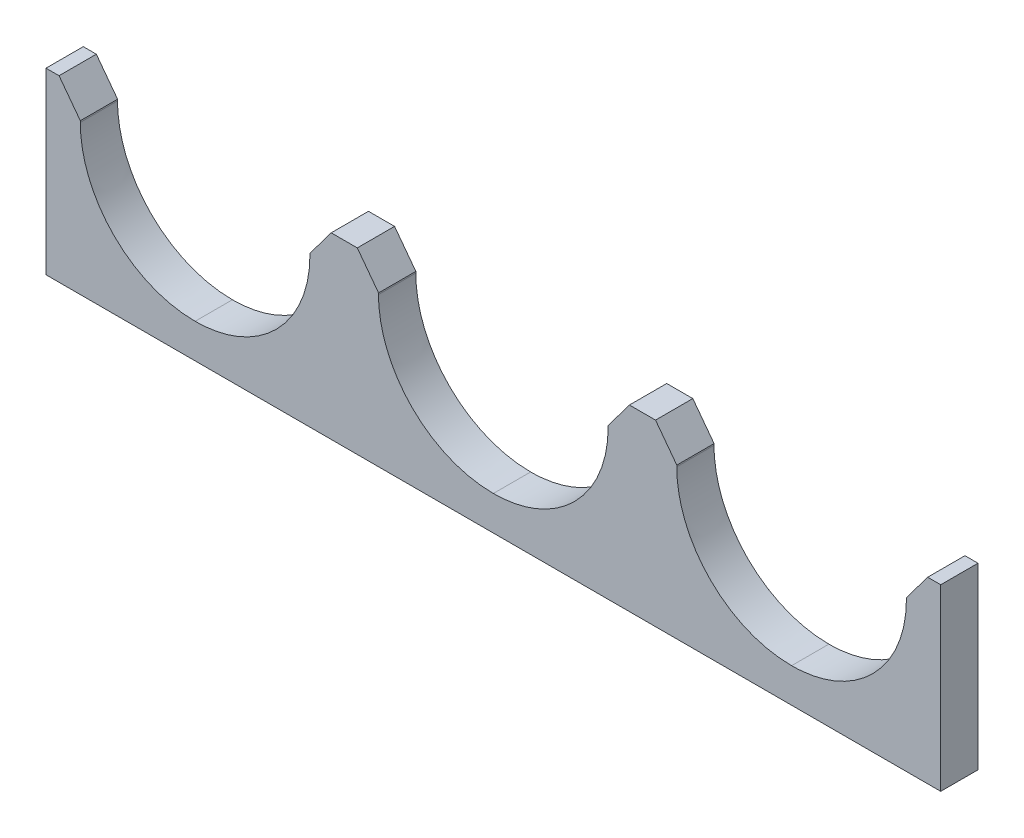
from build123d import *

# Parameters (mm, degrees)
BOSS_EXTRU_1_DEPTH = 12.5


with BuildPart() as part:
    # Model → Boss.-Extru.1 (new body)
    with BuildSketch(Plane.XY):
        with BuildLine():
            Line((245.987396918, -237.241344783), (238.857836405, -227.732795114))
            Line((238.857836405, -227.732795114), (230.104537794, -227.732795114))
            Line((230.104537794, -227.732795114), (222.97495575, -237.241366315))
            add(Edge.make_bspline(
                [(222.97495575, -237.241366315), (222.977001275, -237.405180605), (222.981178453, -237.568499663), (222.981178453, -237.732809186)],
                knots=[7, 7, 7, 7, 8, 8, 8, 8], degree=3))
            add(Edge.make_bspline(
                [(222.981178453, -237.732809186), (222.981178453, -258.995766271), (205.744138421, -276.232806304), (184.481181335, -276.232806304)],
                knots=[8, 8, 8, 8, 9, 9, 9, 9], degree=3))
            add(Edge.make_bspline(
                [(184.481181335, -276.232806304), (163.21822425, -276.232806304), (145.981184218, -258.995766271), (145.981184218, -237.732809186)],
                knots=[9, 9, 9, 9, 10, 10, 10, 10], degree=3))
            add(Edge.make_bspline(
                [(145.981184218, -237.732809186), (145.981184218, -237.568499663), (145.985361396, -237.405180605), (145.987406921, -237.241344783)],
                knots=[10, 10, 10, 10, 11, 11, 11, 11], degree=3))
            Line((145.987406921, -237.241344783), (138.857846408, -227.732795114))
            Line((138.857846408, -227.732795114), (130.104547797, -227.732795114))
            Line((130.104547797, -227.732795114), (122.974965752, -237.241366315))
            add(Edge.make_bspline(
                [(122.974965752, -237.241366315), (122.977011278, -237.405180605), (122.981188456, -237.568499663), (122.981188456, -237.732809186)],
                knots=[14, 14, 14, 14, 15, 15, 15, 15], degree=3))
            add(Edge.make_bspline(
                [(122.981188456, -237.732809186), (122.981188456, -258.995766271), (105.744148424, -276.232806304), (84.481191338, -276.232806304)],
                knots=[15, 15, 15, 15, 16, 16, 16, 16], degree=3))
            add(Edge.make_bspline(
                [(84.481191338, -276.232806304), (63.218212721, -276.232806304), (45.981172689, -258.995766271), (45.981172689, -237.732809186)],
                knots=[16, 16, 16, 16, 17, 17, 17, 17], degree=3))
            add(Edge.make_bspline(
                [(45.981172689, -237.732809186), (45.981172689, -237.568478131), (45.985349867, -237.405180605), (45.987395393, -237.241344783)],
                knots=[17, 17, 17, 17, 18, 18, 18, 18], degree=3))
            Line((45.987395393, -237.241344783), (38.85783488, -227.732795114))
            Line((38.85783488, -227.732795114), (34.481185574, -227.732795114))
            Line((34.481185574, -227.732795114), (34.481185574, -287.732793419))
            Line((34.481185574, -287.732793419), (334.481177097, -287.732793419))
            Line((334.481177097, -287.732793419), (334.481177097, -227.732795114))
            Line((334.481177097, -227.732795114), (330.104570855, -227.732795114))
            Line((330.104570855, -227.732795114), (322.974945747, -237.241366315))
            add(Edge.make_bspline(
                [(322.974945747, -237.241366315), (322.977012804, -237.405180605), (322.981189982, -237.568499663), (322.981189982, -237.732809186)],
                knots=[0, 0, 0, 0, 1, 1, 1, 1], degree=3))
            add(Edge.make_bspline(
                [(322.981189982, -237.732809186), (322.981189982, -258.995766271), (305.744128418, -276.232806304), (284.481171332, -276.232806304)],
                knots=[1, 1, 1, 1, 2, 2, 2, 2], degree=3))
            add(Edge.make_bspline(
                [(284.481171332, -276.232806304), (263.218214247, -276.232806304), (245.981174215, -258.995766271), (245.981174215, -237.732809186)],
                knots=[2, 2, 2, 2, 3, 3, 3, 3], degree=3))
            add(Edge.make_bspline(
                [(245.981174215, -237.732809186), (245.981174215, -237.568478131), (245.985351393, -237.405180605), (245.987396918, -237.241344783)],
                knots=[3, 3, 3, 3, 4, 4, 4, 4], degree=3))
        make_face()
    extrude(amount=BOSS_EXTRU_1_DEPTH)


solid = part.part
